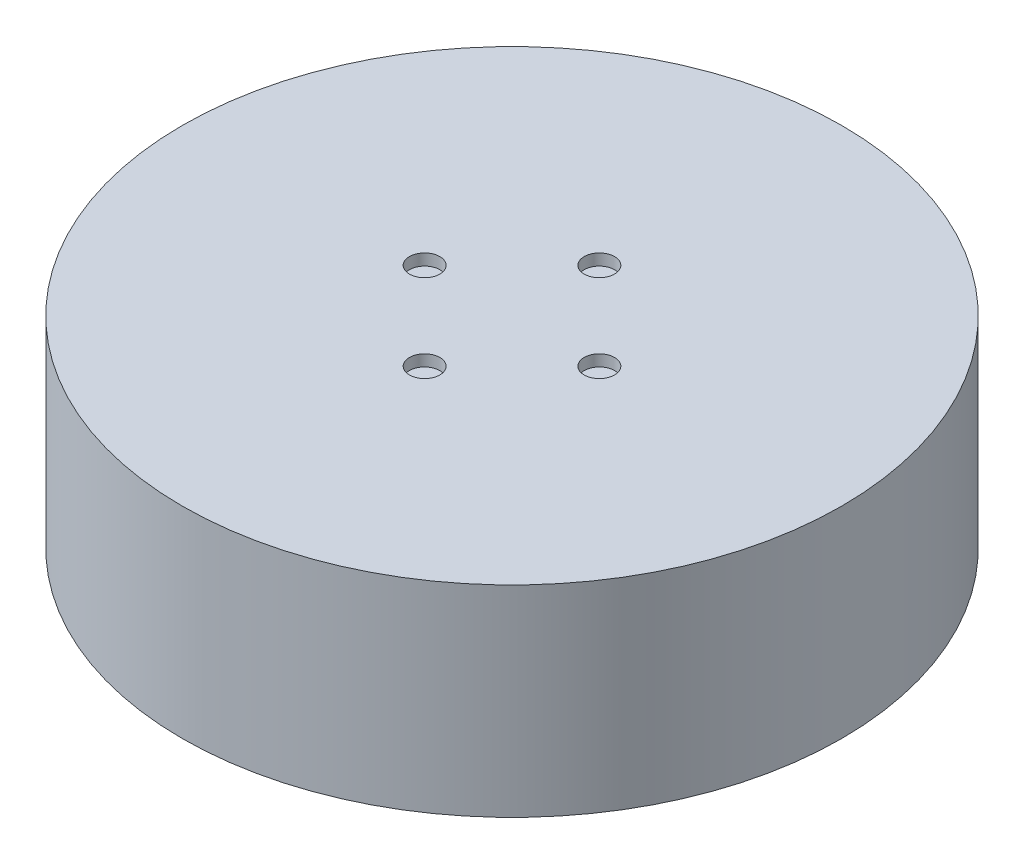
from build123d import *

# Parameters (mm, degrees)
SKETCH1_R           = 43.4
BOSS_EXTRUDE1_DEPTH = 26.5
SKETCH2_R           = 2
CUT_EXTRUDE1_DEPTH  = 1.5
BOSS_EXTRUDE2_DEPTH = 6
SKETCH4_R           = 2
CUT_EXTRUDE2_DEPTH  = 1.5


with BuildPart() as part:
    # Sketch1 → Boss-Extrude1 (new body)
    with BuildSketch(Plane(origin=(0, 0, 0), x_dir=(1, 0, 0), z_dir=(0, 1, 0))):
        with Locations(Location((0, 0, 0), (0, 0, 270))):
            Circle(SKETCH1_R)
    extrude(amount=BOSS_EXTRUDE1_DEPTH)

    # Sketch2 → Cut-Extrude1 (cut)
    with BuildSketch(Plane.XZ):
        with Locations(Location((0, 16, 0), (0, 0, 270))):
            Circle(SKETCH2_R)
        with Locations(Location((16, 0, 0), (0, 0, 270))):
            Circle(SKETCH2_R)
        with Locations(Location((0, -16, 0), (0, 0, 270))):
            Circle(SKETCH2_R)
        with Locations(Location((-16, 0, 0), (0, 0, 270))):
            Circle(SKETCH2_R)
    extrude(amount=-CUT_EXTRUDE1_DEPTH, mode=Mode.SUBTRACT)

    # Sketch3 → Boss-Extrude2 (add)
    with BuildSketch(Plane.XZ):
        with BuildLine():
            Line((19.798989873, 26.870057685), (26.870057685, 19.798989873))
            ThreePointArc((26.870057685, 19.798989873), (26.870057685, 15.556349186), (22.627416998, 15.556349186))
            Line((22.627416998, 15.556349186), (15.556349186, 22.627416998))
            ThreePointArc((15.556349186, 22.627416998), (15.556349186, 26.870057685), (19.798989873, 26.870057685))
        make_face()
    extrude(amount=BOSS_EXTRUDE2_DEPTH)

    # Sketch4 → Cut-Extrude2 (cut)
    with BuildSketch(Plane(origin=(0, 26.5, 0), x_dir=(1, 0, 0), z_dir=(0, 1, 0))):
        with Locations(Location((0, 11.5, 0), (0, 0, 270))):
            Circle(SKETCH4_R)
        with Locations(Location((11.5, 0, 0), (0, 0, 270))):
            Circle(SKETCH4_R)
        with Locations(Location((0, -11.5, 0), (0, 0, 270))):
            Circle(SKETCH4_R)
        with Locations(Location((-11.5, 0, 0), (0, 0, 270))):
            Circle(SKETCH4_R)
    extrude(amount=-CUT_EXTRUDE2_DEPTH, mode=Mode.SUBTRACT)


solid = part.part
